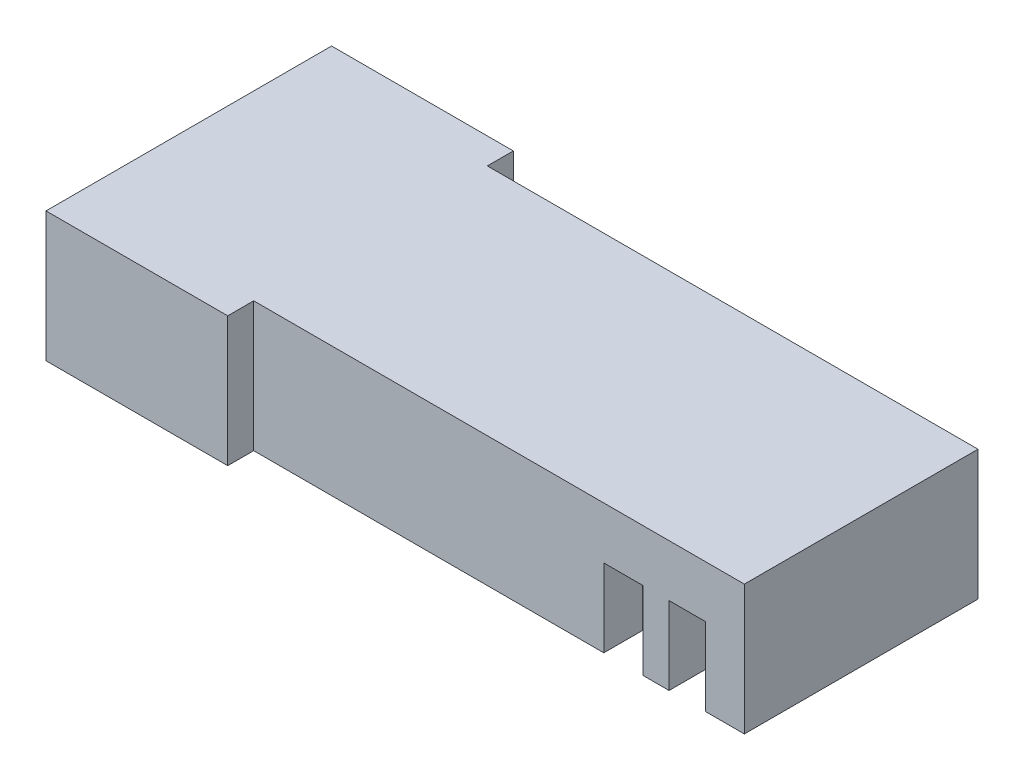
from build123d import *

# Parameters (mm, degrees)
BOSS_EXTRUDE1_DEPTH = 2
BOSS_EXTRUDE2_DEPTH = 3
SKETCH3_W           = 7
SKETCH3_H           = 3.108863517
BOSS_EXTRUDE3_DEPTH = 2


with BuildPart() as part:
    # Sketch1 → Boss-Extrude1 (new body)
    with BuildSketch(Plane(origin=(0, 0, 0), x_dir=(1, 0, 0), z_dir=(0, 1, 0))):
        Polygon((-7.5, -4.5), (7.5, -4.5), (11.4, -4.5), (11.4, 4.5), (7.5, 4.5), (-7.5, 4.5), (-7.5, 5.5), (-14.5, 5.5), (-14.5, -5.5), (-7.5, -5.5), align=None)
    extrude(amount=BOSS_EXTRUDE1_DEPTH)

    # Sketch2 → Boss-Extrude2 (add)
    with BuildSketch(Plane(origin=(0, 0, 0), x_dir=(1, 0, 0), z_dir=(0, 1, 0))):
        Polygon((7.5, 4.5), (-7.5, 4.5), (-7.5, 5.5), (-14.5, 5.5), (-14.5, 3.5), (0.5, 3.5), (0.5, 3), (7.5, 3), (9.9, 3), (9.9, -4.5), (11.4, -4.5), (11.4, 4.5), align=None)
        Polygon((-7.5, -4.5), (-7.5, -5.5), (-14.5, -5.5), (-14.5, -3.5), (0.5, -3.5), (0.5, -3), (5.986157355, -3), (5.986157355, -4.5), align=None)
        Polygon((0.5, 1.6), (7.5, 1.6), (8.5, 1.6), (8.5, -4.5), (7.5, -4.5), (7.5, -1.6), (0.5, -1.6), align=None)
    extrude(amount=-BOSS_EXTRUDE2_DEPTH)

    # Sketch3 → Boss-Extrude3 (add)
    with BuildSketch(Plane.XZ.offset(3)):
        with Locations((-11, 3.945568242)):
            Rectangle(SKETCH3_W, SKETCH3_H)
        with Locations((-11, -3.945568242)):
            Rectangle(SKETCH3_W, SKETCH3_H)
    extrude(amount=-BOSS_EXTRUDE3_DEPTH)


solid = part.part
